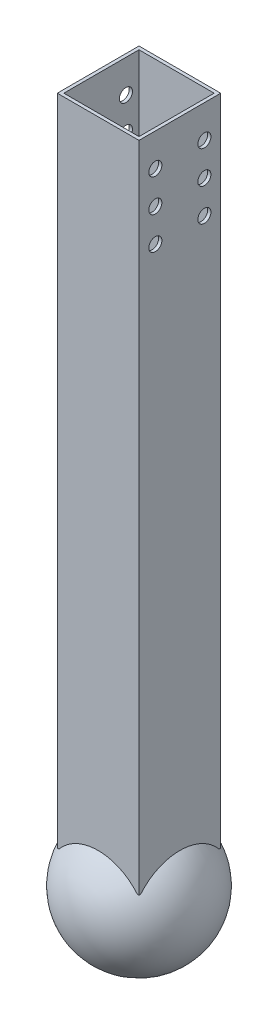
from build123d import *

# Parameters (mm, degrees)
SKETCH1_W           = 25
SKETCH1_H           = 25
SKETCH1_W_2         = 23
SKETCH1_H_2         = 23
BOSS_EXTRUDE1_DEPTH = 200
SKETCH3_R           = 2
CUT_EXTRUDE1_DEPTH  = 25


with BuildPart() as part:
    # Sketch1 → Boss-Extrude1 (new body)
    with BuildSketch(Plane(origin=(0, 0, 0), x_dir=(1, 0, 0), z_dir=(0, 1, 0))):
        Rectangle(SKETCH1_W, SKETCH1_H)
        Rectangle(SKETCH1_W_2, SKETCH1_H_2, mode=Mode.SUBTRACT)
    extrude(amount=BOSS_EXTRUDE1_DEPTH)

    # Sketch2 → Revolve1 (revolve)
    with BuildSketch(Plane(origin=(0, -10, 0), x_dir=(-1, 0, 0), z_dir=(0, -1, 0))):
        with BuildLine():
            Line((0, 19), (0, 20))
            ThreePointArc((0, 20), (-20, 0), (0, -20))
            Line((0, -20), (0, -19))
            ThreePointArc((0, -19), (-19, 0), (0, 19))
        make_face()
    revolve(axis=Axis((0, -10, -20), (0, 0, 1)))

    # Sketch3 → Cut-Extrude1 (cut)
    with BuildSketch(Plane(origin=(12.5, 0, 0), x_dir=(0, 0, -1), z_dir=(1, 0, 0))):
        with Locations((7.5, 190)):
            Circle(SKETCH3_R)
        with Locations((7.5, 180)):
            Circle(SKETCH3_R)
        with Locations((-7.5, 190)):
            Circle(SKETCH3_R)
        with Locations((-7.5, 180)):
            Circle(SKETCH3_R)
        with Locations((7.5, 170)):
            Circle(SKETCH3_R)
        with Locations((-7.5, 170)):
            Circle(SKETCH3_R)
    extrude(amount=-CUT_EXTRUDE1_DEPTH, mode=Mode.SUBTRACT)


solid = part.part
